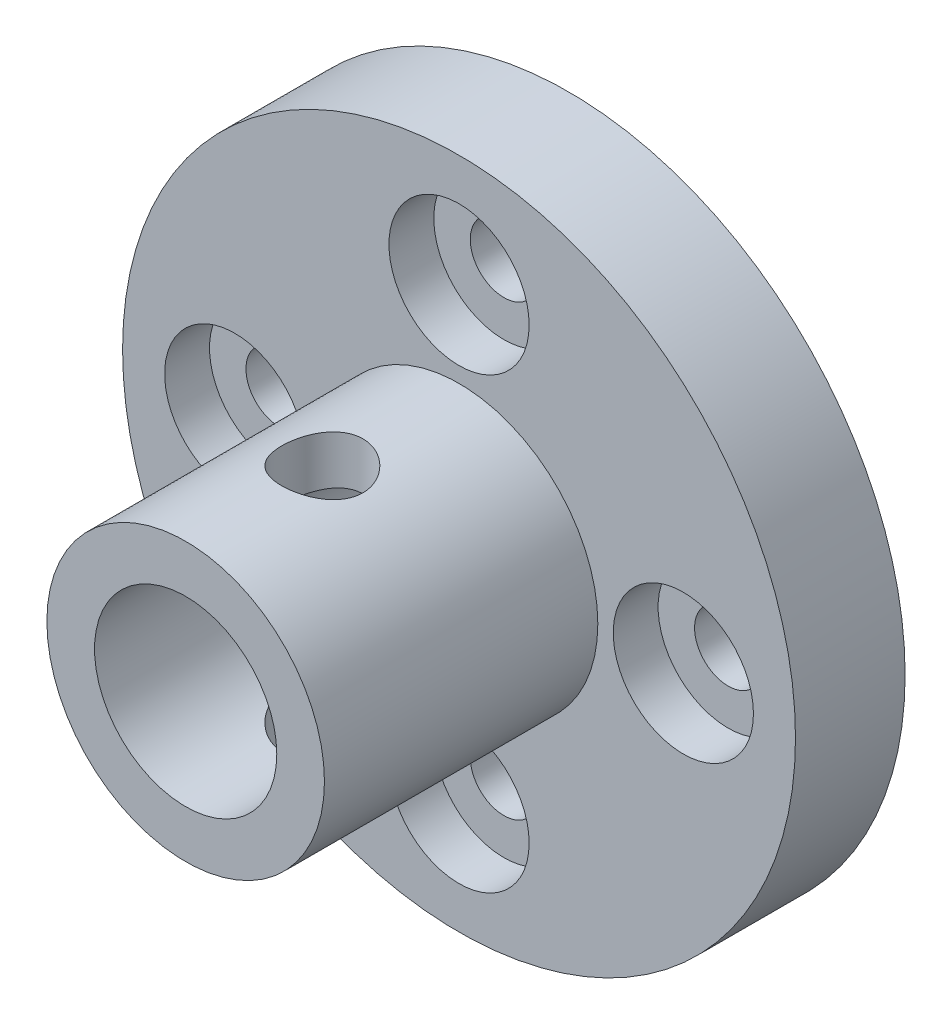
from build123d import *

# Parameters (mm, degrees)
ESQUISSE1_R                                        = 12
BOSS_EXTRU_1_DEPTH                                 = 3.91
ESQUISSE6_R                                        = 4
ENL_V_MAT_EXTRU_2_DEPTH                            = 1.91
ESQUISSE7_R                                        = 4.95
ESQUISSE7_R_2                                      = 3.25
BOSS_EXTRU_2_DEPTH                                 = 9.75
CHAMBRAGE_POUR_VIS_T_TE_RONDE_BOMB_E_M_D           = 2.4
CHAMBRAGE_POUR_VIS_T_TE_RONDE_BOMB_E_M_CBORE_D     = 5
CHAMBRAGE_POUR_VIS_T_TE_RONDE_BOMB_E_M_CBORE_DEPTH = 1.6
R_P_TITION_CIRCULAIRE2_COUNT                       = 4
ENL_V_MAT_EXTRU_3_DEPTH                            = 22.78521517
ENL_V_MAT_EXTRU_3_DEPTH_BACK                       = 22.78521517
ESQUISSE12_R                                       = 1.45


with BuildPart() as part:
    # Esquisse1 → Boss.-Extru.1 (new body)
    with BuildSketch(Plane.XY):
        Circle(ESQUISSE1_R)
    extrude(amount=BOSS_EXTRU_1_DEPTH)

    # Esquisse6 → Enlèv. mat.-Extru.2 (cut)
    with BuildSketch(Plane(origin=(0, 0, 0), x_dir=(-1, 0, 0), z_dir=(0, 0, -1))):
        Circle(ESQUISSE6_R)
    extrude(amount=-ENL_V_MAT_EXTRU_2_DEPTH, mode=Mode.SUBTRACT)

    # Esquisse7 → Boss.-Extru.2 (add)
    with BuildSketch(Plane.XY.offset(3.91)):
        Circle(ESQUISSE7_R)
        Circle(ESQUISSE7_R_2, mode=Mode.SUBTRACT)
    extrude(amount=BOSS_EXTRU_2_DEPTH)

    # Chambrage pour vis à tête ronde bombée M21 (through all)
    with Locations(Plane.XY.offset(3.91)):
        with Locations((0, 8)):
            chambrage_pour_vis_t_te_ronde_bomb_e_m = CounterBoreHole(CHAMBRAGE_POUR_VIS_T_TE_RONDE_BOMB_E_M_D / 2, CHAMBRAGE_POUR_VIS_T_TE_RONDE_BOMB_E_M_CBORE_D / 2, CHAMBRAGE_POUR_VIS_T_TE_RONDE_BOMB_E_M_CBORE_DEPTH)

    # Répétition circulaire2: Chambrage pour vis à tête ronde bombée M21 ×4 about axis
    r_p_tition_circulaire2_axis = Axis((0, 0, 0), (0, 0, 1))
    for i in range(1, R_P_TITION_CIRCULAIRE2_COUNT):
        add(chambrage_pour_vis_t_te_ronde_bomb_e_m.rotate(r_p_tition_circulaire2_axis, i * 360 / R_P_TITION_CIRCULAIRE2_COUNT), mode=Mode.SUBTRACT)

    # Esquisse12 → Enlèv. mat.-Extru.3 (cut, two sides: drawn at the far end of the back side and taken through both)
    with BuildSketch(Plane(origin=(0, 0, 0), x_dir=(1, 0, 0), z_dir=(0, 1, 0)).offset(-ENL_V_MAT_EXTRU_3_DEPTH_BACK)):
        with Locations(Location((0, -8.785, 0), (0, 0, 270))):
            Circle(ESQUISSE12_R)
    extrude(amount=ENL_V_MAT_EXTRU_3_DEPTH + ENL_V_MAT_EXTRU_3_DEPTH_BACK, mode=Mode.SUBTRACT)


solid = part.part
